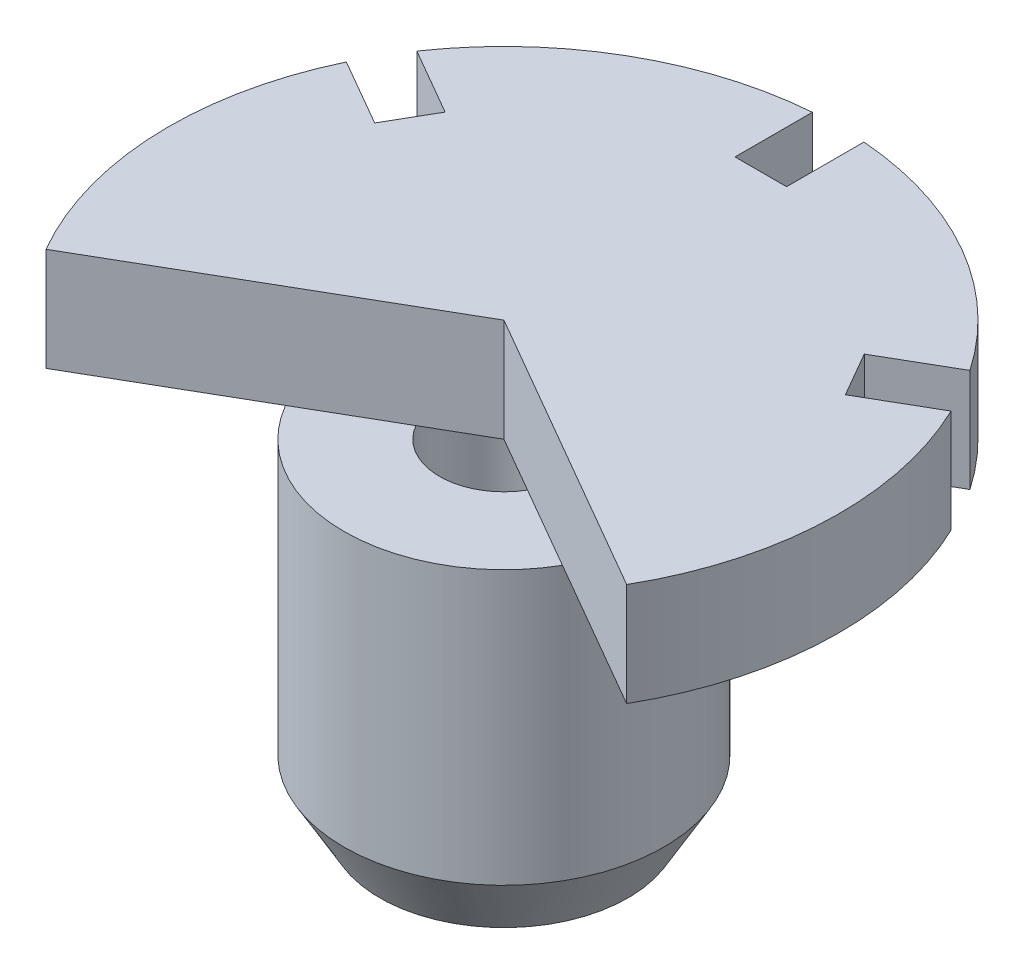
from build123d import *

# Parameters (mm, degrees)
ESTRUSIONE_ESTRUSIONE1_DEPTH = 20
SCHIZZO2_R                   = 31
ESTRUSIONE_ESTRUSIONE2_DEPTH = 65
SCHIZZO3_R                   = 20
TAGLIO_ESTRUSIONE1_DEPTH     = 26
FORO_25_0_25_1_D             = 25
FORO_25_0_25_1_DEPTH         = 39
FORO_6_0_6_1_REACH           = 113.724
FORO_6_0_6_1_BORE_R          = 3
SMUSSO1_SIZE                 = 12
SMUSSO1_SIZE2                = 6.92820323


with BuildPart() as part:
    # Schizzo1 → Estrusione-Estrusione1 (new body)
    with BuildSketch(Plane(origin=(0, 0, 0), x_dir=(1, 0, 0), z_dir=(0, 1, 0))):
        with BuildLine():
            Line((0, 0), (-56.291651246, -32.5))
            ThreePointArc((-56.291651246, -32.5), (-64.9518339, -2.501853916), (-58.624860802, 28.073576473))
            Line((-58.624860802, 28.073576473), (-45.634479745, 20.573576473))
            Line((-45.634479745, 20.573576473), (-40.634479745, 29.233830511))
            Line((-40.634479745, 29.233830511), (-53.624860802, 36.733830511))
            ThreePointArc((-53.624860802, 36.733830511), (-32.5, 56.291651246), (-5, 64.807406984))
            Line((-5, 64.807406984), (-5, 49.807406984))
            Line((-5, 49.807406984), (5, 49.807406984))
            Line((5, 49.807406984), (5, 64.807406984))
            ThreePointArc((5, 64.807406984), (32.5, 56.291651246), (53.624860802, 36.733830511))
            Line((53.624860802, 36.733830511), (40.634479745, 29.233830511))
            Line((40.634479745, 29.233830511), (45.634479745, 20.573576473))
            Line((45.634479745, 20.573576473), (58.624860802, 28.073576473))
            ThreePointArc((58.624860802, 28.073576473), (64.9518339, -2.501853916), (56.291651246, -32.5))
            Line((56.291651246, -32.5), (0, 0))
        make_face()
    extrude(amount=ESTRUSIONE_ESTRUSIONE1_DEPTH)

    # Schizzo2 → Estrusione-Estrusione2 (add)
    with BuildSketch(Plane.XZ):
        with Locations(Location((0, 0, 0), (0, 0, 150))):
            Circle(SCHIZZO2_R)
    extrude(amount=ESTRUSIONE_ESTRUSIONE2_DEPTH)

    # Schizzo3 → Taglio-Estrusione1 (cut)
    with BuildSketch(Plane.XZ.offset(65)):
        with Locations(Location((0, 0, 0), (0, 0, 270))):
            Circle(SCHIZZO3_R)
    extrude(amount=-TAGLIO_ESTRUSIONE1_DEPTH, mode=Mode.SUBTRACT)

    # Foro Ø25.0 (25)-1
    with Locations(Plane(origin=(0, -39, 0), x_dir=(-1, 0, 0), z_dir=(0, -1, 0))):
        with Locations((0, 0)):
            Hole(FORO_25_0_25_1_D / 2, depth=FORO_25_0_25_1_DEPTH)

    # Foro Ø6.0 (6)-1 bore → Foro Ø6.0 (6)-1 (cut, up to next)
    with BuildSketch(Plane(origin=(0, 0, -31), x_dir=(-1, 0, 0), z_dir=(0, 0, -1)), mode=Mode.PRIVATE) as foro_6_0_6_1_sk1:
        with Locations((0, -13)):
            Circle(FORO_6_0_6_1_BORE_R)
    foro_6_0_6_1_tool1 = extrude(foro_6_0_6_1_sk1.sketch, amount=-FORO_6_0_6_1_REACH, mode=Mode.PRIVATE) & part.part
    add(foro_6_0_6_1_tool1.solids().sort_by_distance((0, -13, -31))[0], mode=Mode.SUBTRACT)

    # Smusso1
    smusso1_edges = [part.edges().sort_by_distance(p)[0] for p in [
        (26.846787517, -65, -15.5),
    ]]
    smusso1_side = [part.faces().sort_by_distance(p)[0] for p in [
        (26.846787517, -32.5, -15.5),
    ]]
    chamfer(smusso1_edges, length=SMUSSO1_SIZE, length2=SMUSSO1_SIZE2, reference=smusso1_side[0])


solid = part.part
